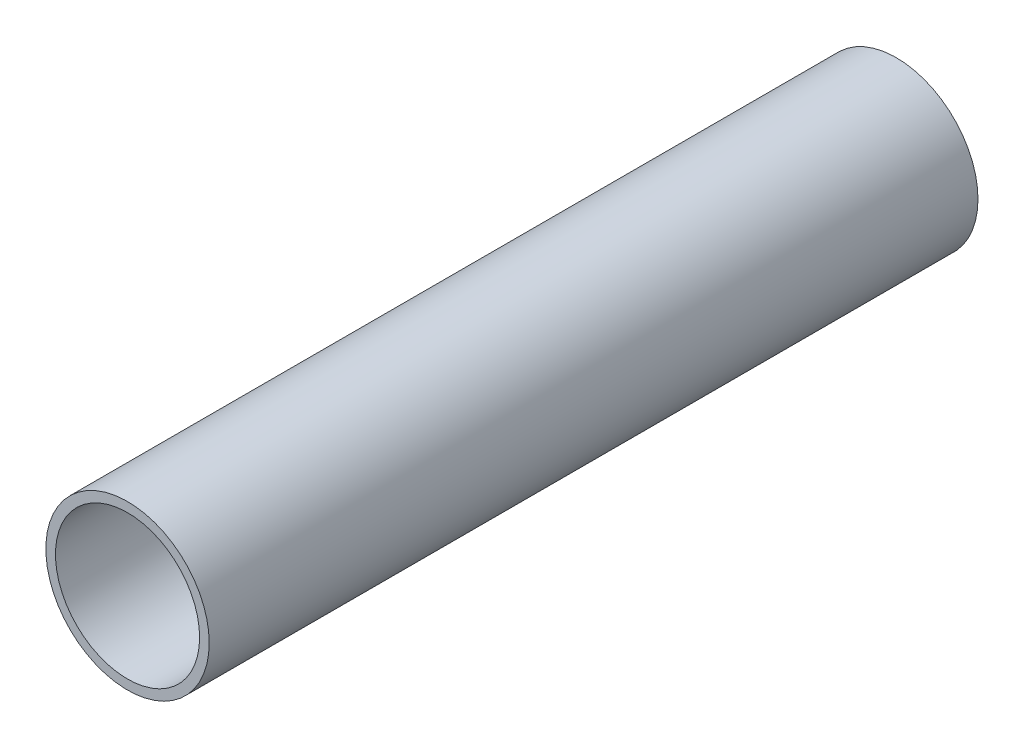
from build123d import *

# Parameters (mm, degrees)
SKETCH1_R           = 17
SKETCH1_R_2         = 15
BOSS_EXTRUDE1_DEPTH = 80


with BuildPart() as part:
    # Sketch1 → Boss-Extrude1 (new, symmetric)
    with BuildSketch(Plane.XY):
        Circle(SKETCH1_R)
        Circle(SKETCH1_R_2, mode=Mode.SUBTRACT)
    extrude(amount=BOSS_EXTRUDE1_DEPTH, both=True)


solid = part.part
